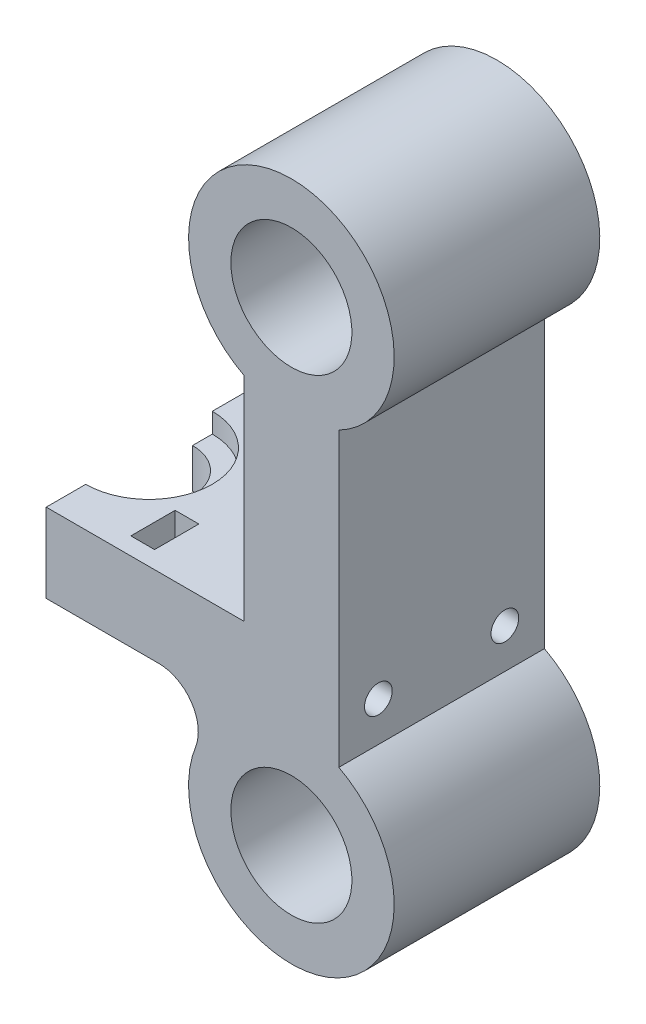
from build123d import *

# Parameters (mm, degrees)
ESBO_O1_R                = 7.65
RESSALTO_EXTRUS_O1_DEPTH = 26
ESBO_O4_R                = 1.75
CORTE_EXTRUS_O1_DEPTH    = 67.790717918
ESBO_O5_W                = 3
ESBO_O5_H                = 5.6
CORTE_EXTRUS_O2_DEPTH    = 25


with BuildPart() as part:
    # Esboço1 → Ressalto-extrusão1 (new body)
    with BuildSketch(Plane.XY):
        with BuildLine():
            Line((-6, 18.467437405), (-6, -8.467437405))
            Line((-6, -8.467437405), (-31, -8.467437405))
            Line((-31, -8.467437405), (-31, -18.467437405))
            Line((-31, -18.467437405), (-16.77276441, -18.467437405))
            ThreePointArc((-16.77276441, -18.467437405), (-12.645234664, -20.645470326), (-12.113663185, -25.282038126))
            ThreePointArc((-12.113663185, -25.282038126), (4.577544662, -42.16741899), (6, -18.467437405))
            Line((6, -18.467437405), (6, 18.467437405))
            ThreePointArc((6, 18.467437405), (0, 43), (-6, 18.467437405))
        make_face()
        with Locations(Location((0, 30, 0), (0, 0, 180))):
            Circle(ESBO_O1_R, mode=Mode.SUBTRACT)
        with Locations(Location((0, -30, 0), (0, 0, 180))):
            Circle(ESBO_O1_R, mode=Mode.SUBTRACT)
    extrude(amount=RESSALTO_EXTRUS_O1_DEPTH)

    # Esboço3 → Corte-Revolução1 (revolve, cut)
    with BuildSketch(Plane.ZY.offset(31)):
        Polygon((13, -8.467437405), (21, -8.467437405), (21, -10.967437405), (18.5, -10.967437405), (18.5, -15.967437405), (21, -15.967437405), (21, -18.467437405), (13, -18.467437405), align=None)
    revolve(axis=Axis((-31, -8.467437405, 13), (0, -1, 0)), mode=Mode.SUBTRACT)

    # Esboço4 → Corte-extrusão1 (cut, through all)
    with BuildSketch(Plane.ZY.offset(31)):
        with Locations((5, -13.467437405)):
            Circle(ESBO_O4_R)
        with Locations(Location((21, -13.467437405, 0), (0, 0, 270))):
            Circle(ESBO_O4_R)
    extrude(amount=-CORTE_EXTRUS_O1_DEPTH, mode=Mode.SUBTRACT)

    # Esboço5 → Corte-extrusão2 (cut)
    with BuildSketch(Plane(origin=(0, -8.467437405, 0), x_dir=(1, 0, 0), z_dir=(0, 1, 0))):
        with Locations((-21, -5)):
            Rectangle(ESBO_O5_W, ESBO_O5_H)
        with Locations((-21, -21)):
            Rectangle(ESBO_O5_W, ESBO_O5_H)
    extrude(amount=-CORTE_EXTRUS_O2_DEPTH, mode=Mode.SUBTRACT)


solid = part.part
